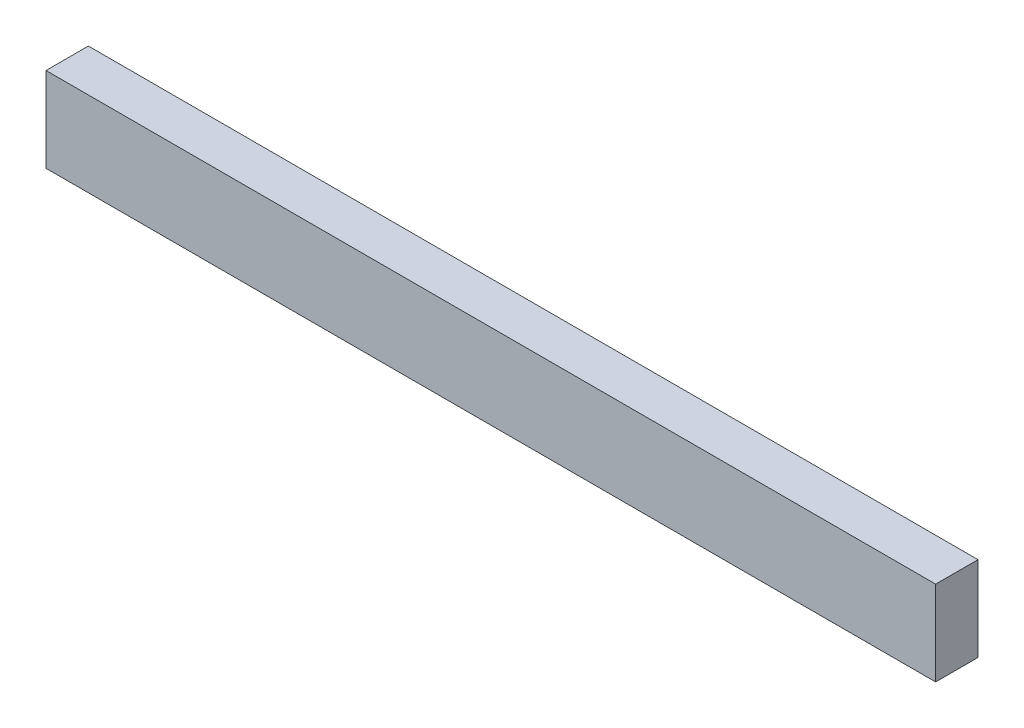
from build123d import *

# Parameters (mm, degrees)
CROQUIS1_W              = 5
CROQUIS1_H              = 10
SALIENTE_EXTRUIR1_DEPTH = 105


with BuildPart() as part:
    # Croquis1 → Saliente-Extruir1 (new body)
    with BuildSketch(Plane(origin=(0, 0, 0), x_dir=(0, 0, -1), z_dir=(1, 0, 0))):
        Rectangle(CROQUIS1_W, CROQUIS1_H)
    extrude(amount=SALIENTE_EXTRUIR1_DEPTH)


solid = part.part
